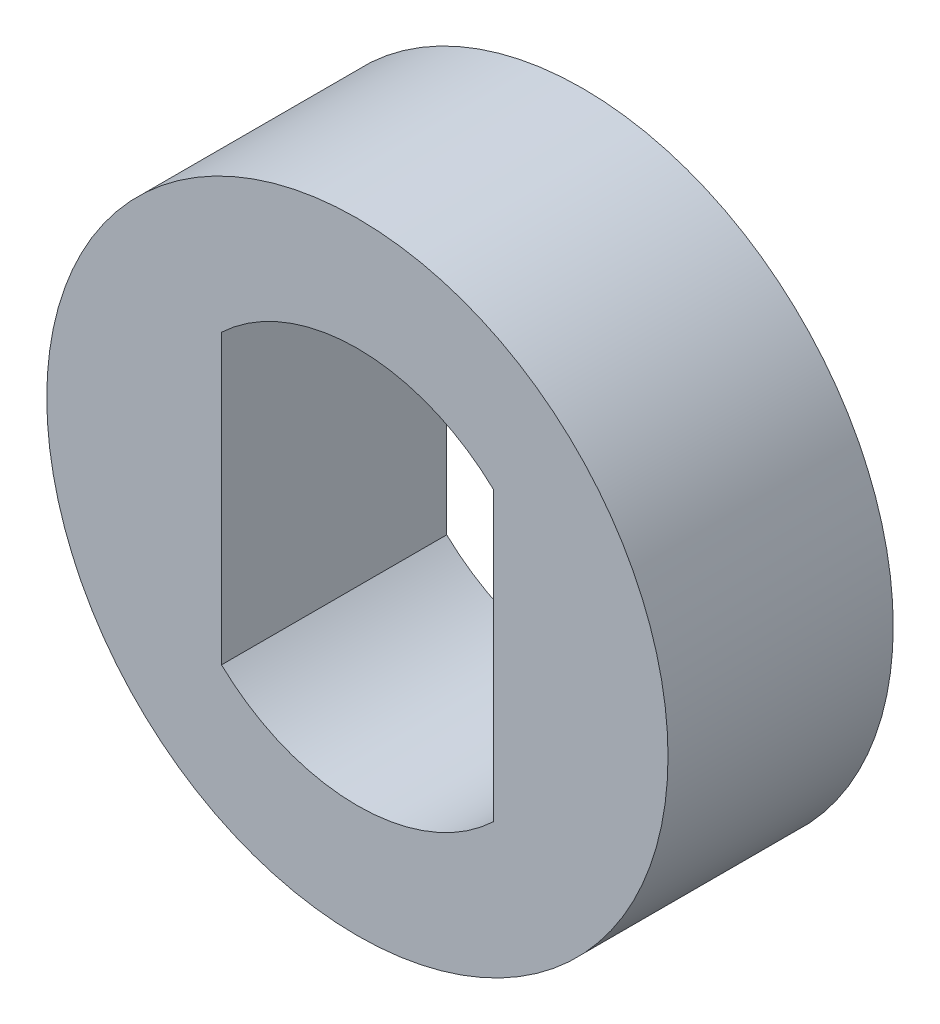
from build123d import *

# Parameters (mm, degrees)
SKETCH1_R           = 4
BOSS_EXTRUDE1_DEPTH = 1.45


with BuildPart() as part:
    # Sketch1 → Boss-Extrude1 (new, symmetric)
    with BuildSketch(Plane.XY):
        Circle(SKETCH1_R)
        with BuildLine():
            Line((1.75, -1.854723699), (1.75, 1.854723699))
            ThreePointArc((1.75, 1.854723699), (0, 2.55), (-1.75, 1.854723699))
            Line((-1.75, 1.854723699), (-1.75, -1.854723699))
            ThreePointArc((-1.75, -1.854723699), (0, -2.55), (1.75, -1.854723699))
        make_face(mode=Mode.SUBTRACT)
    extrude(amount=BOSS_EXTRUDE1_DEPTH, both=True)


solid = part.part
